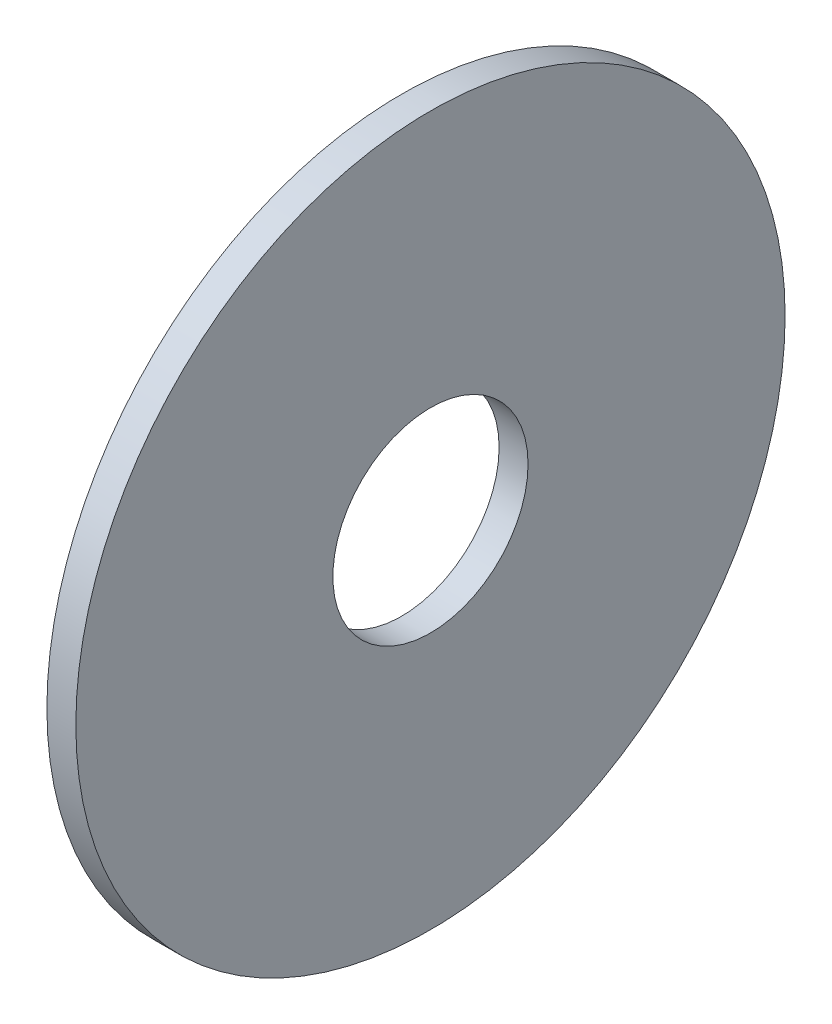
from build123d import *

# Parameters (mm, degrees)
SKETCH1_R           = 15.875
SKETCH1_R_2         = 4.3688
BOSS_EXTRUDE1_DEPTH = 1.2954


with BuildPart() as part:
    # Sketch1 → Boss-Extrude1 (new body)
    with BuildSketch(Plane(origin=(0, 0, 0), x_dir=(0, 0, -1), z_dir=(1, 0, 0))):
        Circle(SKETCH1_R)
        Circle(SKETCH1_R_2, mode=Mode.SUBTRACT)
    extrude(amount=BOSS_EXTRUDE1_DEPTH)


solid = part.part
